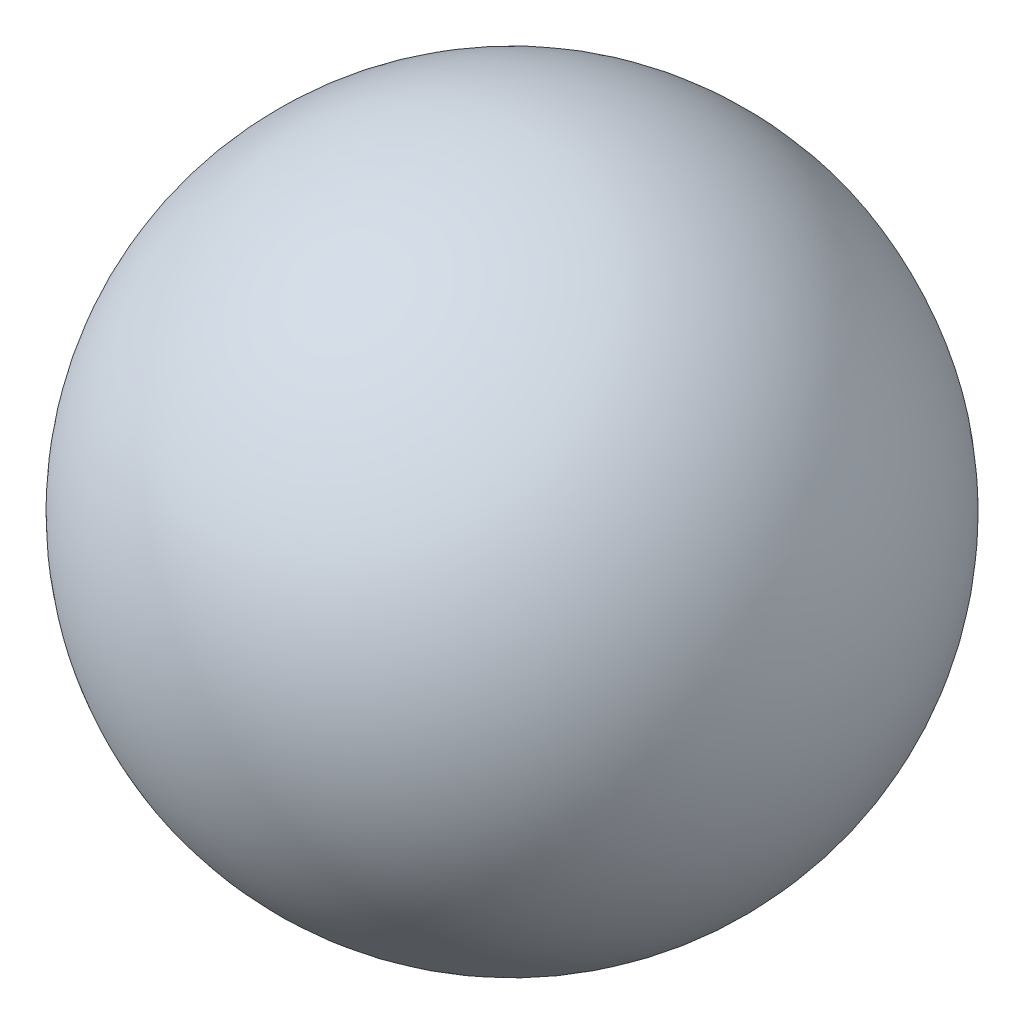
from build123d import *


with BuildPart() as part:
    # 草图2 → 旋转1 (revolve)
    with BuildSketch(Plane(origin=(0, 0, 0), x_dir=(1, 0, 0), z_dir=(0, 1, 0))):
        with BuildLine():
            Line((7.155, -36.664917873), (6.82423803, -37.84118119))
            ThreePointArc((6.82423803, -37.84118119), (9.835964598, -49.442337953), (0, -56.291508384))
            Line((0, -56.291508384), (0, -56.806659451))
            ThreePointArc((0, -56.806659451), (10.687419928, -49.261462864), (7.155, -36.664917873))
        make_face()
    revolve(axis=Axis((0, 0, 56.291508384), (0, 0, 1)))


solid = part.part
